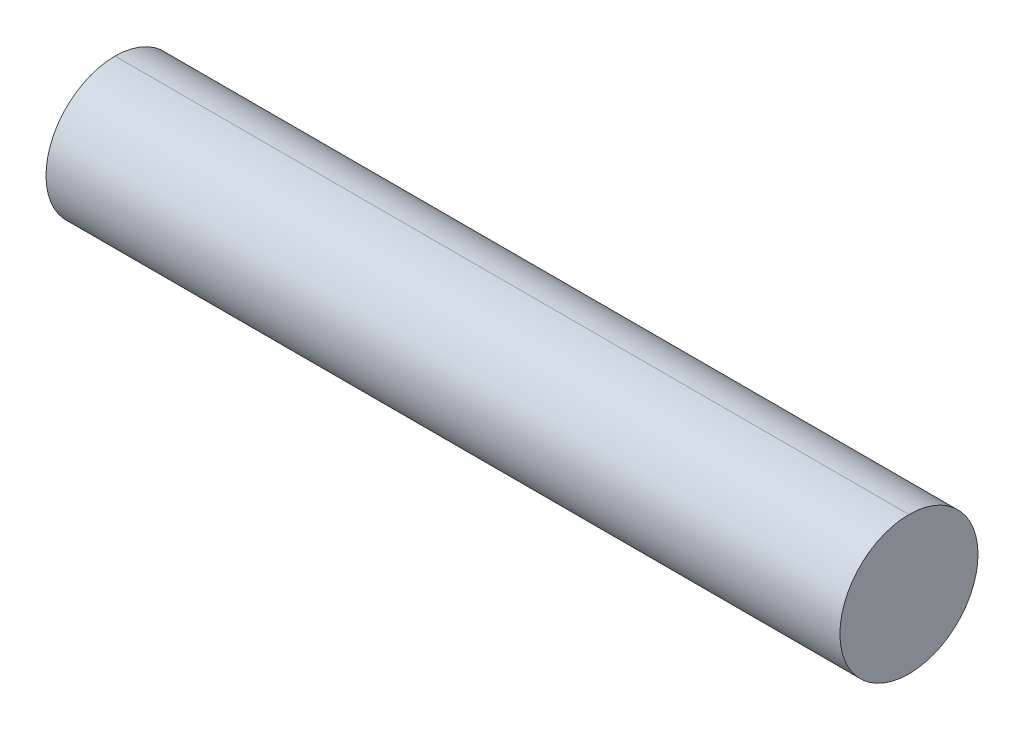
from build123d import *

# Parameters (mm, degrees)
SKETCH1_R           = 12.7
BOSS_EXTRUDE1_DEPTH = 146.05


with BuildPart() as part:
    # Sketch1 → Boss-Extrude1 (new body)
    with BuildSketch(Plane(origin=(0, 0, 0), x_dir=(0, 0, -1), z_dir=(1, 0, 0))):
        Circle(SKETCH1_R)
    extrude(amount=BOSS_EXTRUDE1_DEPTH)


solid = part.part
